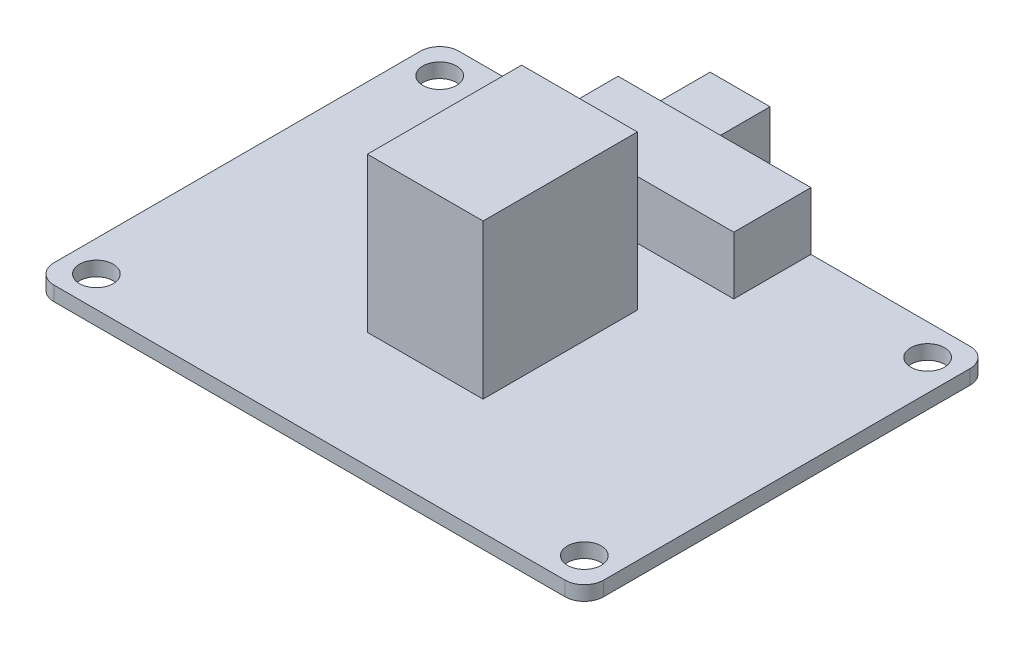
from build123d import *

# Parameters (mm, degrees)
SKETCH1_W           = 57
SKETCH1_H           = 42
BOSS_EXTRUDE1_DEPTH = 1.5
SKETCH2_R           = 1.75
CUT_EXTRUDE1_DEPTH  = 10
SKETCH3_W           = 12
SKETCH3_H           = 16
SKETCH3_W_2         = 20
SKETCH3_H_2         = 8
BOSS_EXTRUDE2_DEPTH = 6
SKETCH4_W           = 6.209741393
SKETCH4_H           = 5.053024859
BOSS_EXTRUDE3_DEPTH = 6
FILLET3_R           = 2
SKETCH7_W           = 12
SKETCH7_H           = 16
BOSS_EXTRUDE6_DEPTH = 10


with BuildPart() as part:
    # Sketch1 → Boss-Extrude1 (new body)
    with BuildSketch(Plane(origin=(0, 0, 0), x_dir=(1, 0, 0), z_dir=(0, 1, 0))):
        Rectangle(SKETCH1_W, SKETCH1_H)
    extrude(amount=BOSS_EXTRUDE1_DEPTH)

    # Sketch2 → Cut-Extrude1 (cut)
    with BuildSketch(Plane(origin=(0, 1.5, 0), x_dir=(1, 0, 0), z_dir=(0, 1, 0))):
        with Locations(Location((-25.3, 17.8, 0), (0, 0, 270))):
            Circle(SKETCH2_R)
        with Locations(Location((-25.3, -17.8, 0), (0, 0, 270))):
            Circle(SKETCH2_R)
        with Locations(Location((25.3, -17.8, 0), (0, 0, 270))):
            Circle(SKETCH2_R)
        with Locations(Location((25.3, 17.8, 0), (0, 0, 270))):
            Circle(SKETCH2_R)
    extrude(amount=-CUT_EXTRUDE1_DEPTH, mode=Mode.SUBTRACT)

    # Sketch3 → Boss-Extrude2 (add)
    with BuildSketch(Plane(origin=(0, 1.5, 0), x_dir=(1, 0, 0), z_dir=(0, 1, 0))):
        with Locations((0, -1)):
            Rectangle(SKETCH3_W, SKETCH3_H)
        with Locations((0, 17)):
            Rectangle(SKETCH3_W_2, SKETCH3_H_2)
    extrude(amount=BOSS_EXTRUDE2_DEPTH)

    # Sketch4 → Boss-Extrude3 (add)
    with BuildSketch(Plane(origin=(0, 0, -21), x_dir=(-1, 0, 0), z_dir=(0, 0, -1))):
        with Locations((3.348389967, 4.115278906)):
            Rectangle(SKETCH4_W, SKETCH4_H)
    extrude(amount=BOSS_EXTRUDE3_DEPTH)

    # Fillet3
    fillet3_edges = [part.edges().sort_by_distance(p)[0] for p in [
        (28.5, 0.75, 21),
        (-28.5, 0.75, 21),
        (-28.5, 0.75, -21),
        (28.5, 0.75, -21),
    ]]
    fillet(fillet3_edges, radius=FILLET3_R)

    # Sketch7 → Boss-Extrude6 (add)
    with BuildSketch(Plane(origin=(0, 7.5, 0), x_dir=(1, 0, 0), z_dir=(0, 1, 0))):
        with Locations((0, -1)):
            Rectangle(SKETCH7_W, SKETCH7_H)
    extrude(amount=BOSS_EXTRUDE6_DEPTH)


solid = part.part
